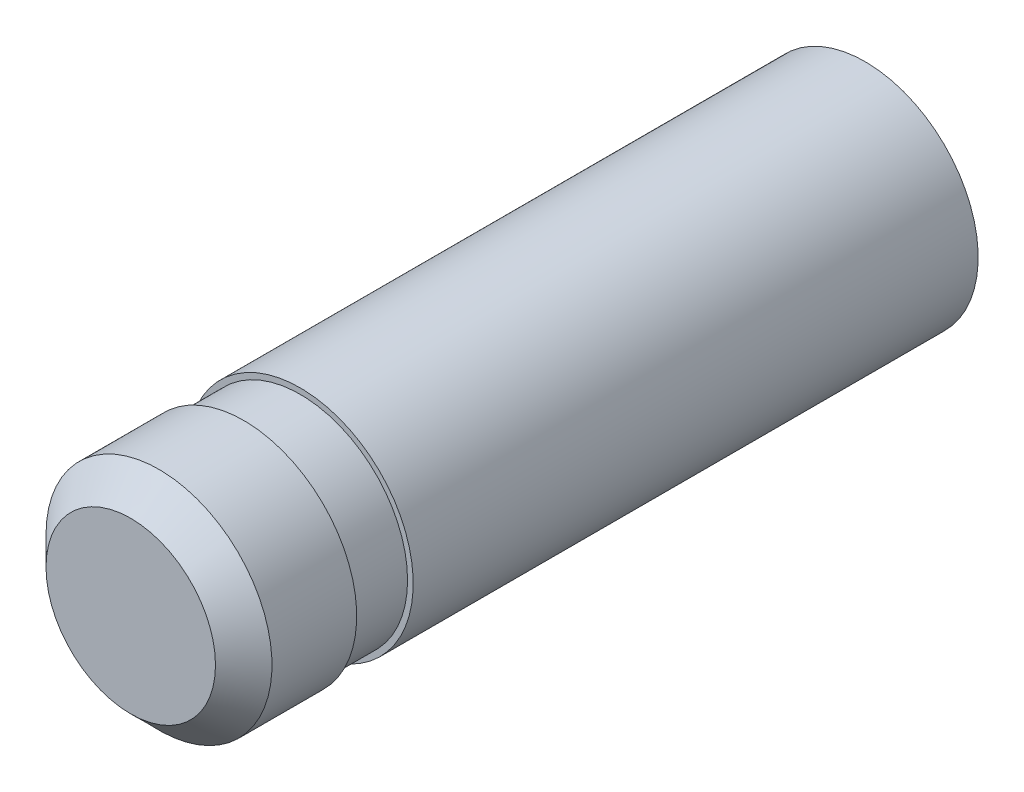
from build123d import *

# Parameters (mm, degrees)
SKETCH1_R           = 2
BOSS_EXTRUDE1_DEPTH = 13
CUT_EXTRUDE1_START  = -10
SKETCH2_OUTSIDE_W   = 8.836
SKETCH2_OUTSIDE_H   = 8.836
SKETCH2_OUTSIDE_R   = 1.9
CUT_EXTRUDE1_DEPTH  = 1
CHAMFER1_SIZE       = 0.5
SCALE1_SCALE        = 1.5


with BuildPart() as part:
    # Sketch1 → Boss-Extrude1 (new body)
    with BuildSketch(Plane.XY):
        with Locations(Location((0, 0, 0), (0, 0, 180))):
            Circle(SKETCH1_R)
    extrude(amount=BOSS_EXTRUDE1_DEPTH)

    # Sketch2 outside → Cut-Extrude1 (cut)
    with BuildSketch(Plane(origin=(0, 0, 0), x_dir=(-1, 0, 0), z_dir=(0, 0, -1)).offset(CUT_EXTRUDE1_START)):
        Rectangle(SKETCH2_OUTSIDE_W, SKETCH2_OUTSIDE_H)
        Circle(SKETCH2_OUTSIDE_R, mode=Mode.SUBTRACT)
    extrude(amount=-CUT_EXTRUDE1_DEPTH, mode=Mode.SUBTRACT)

    # Chamfer1
    chamfer1_edges = [part.edges().sort_by_distance(p)[0] for p in [
        (2, 0, 13),
    ]]
    chamfer(chamfer1_edges, length=CHAMFER1_SIZE)


with BuildPart() as part_1:
    # Scale1: scaled about (0, 0, 6.412787951)
    add(part.part.scale(SCALE1_SCALE).moved(Location((0, 0, -3.206393976))))


solid = part_1.part
